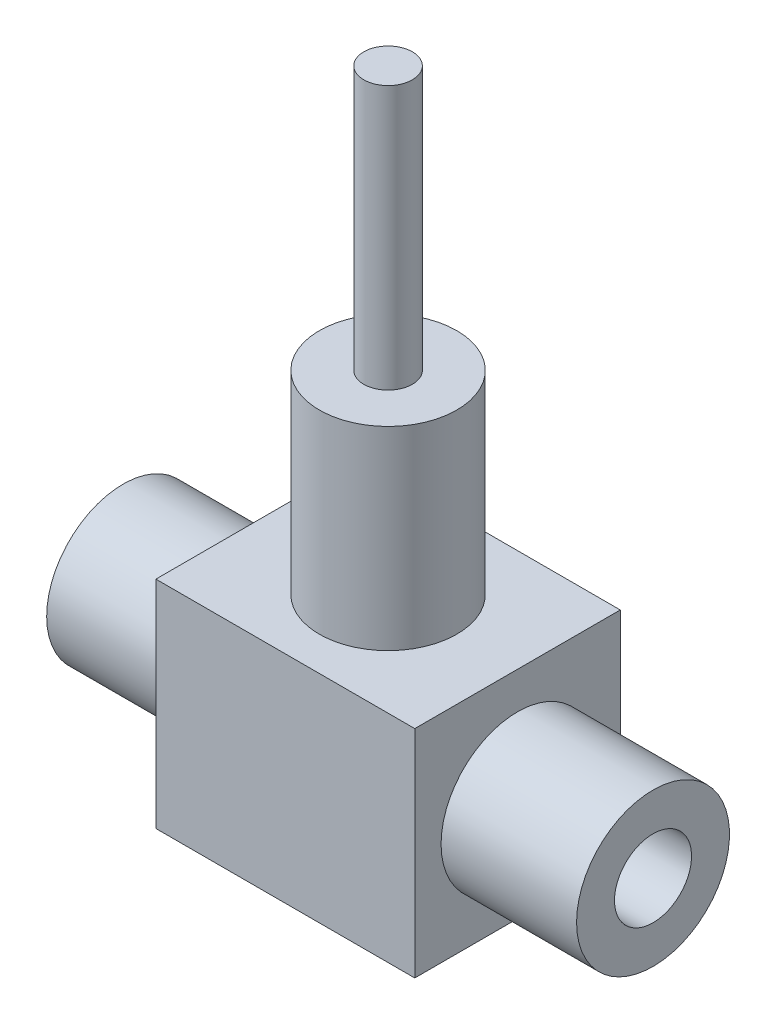
from build123d import *

# Parameters (mm, degrees)
BODY_SKETCH_W       = 32
BODY_SKETCH_H       = 26.7
BODY_DEPTH          = 12.7
NUT_X_SKETCH_W      = 16.75
NUT_X_SKETCH_H      = 9.45
NUT_X_SKETCH_2_W    = 16.75
NUT_X_SKETCH_2_H    = 9.45
SOCKET_X_SKETCH_W   = 17.8
SOCKET_X_SKETCH_H   = 4.7625
SOCKET_X_SKETCH_2_W = 17.8
SOCKET_X_SKETCH_2_H = 4.7625


with BuildPart() as part:
    # Body Sketch → Body (new, symmetric)
    with BuildSketch(Plane.XY):
        with Locations((0, 0.65)):
            Rectangle(BODY_SKETCH_W, BODY_SKETCH_H)
    extrude(amount=BODY_DEPTH, both=True)

    # Nut _X Sketch → Nut _X (revolve)
    with BuildSketch(Plane.XY):
        with Locations((24.375, 4.725)):
            Rectangle(NUT_X_SKETCH_W, NUT_X_SKETCH_H)
    revolve(axis=Axis((-1000, 0, 0), (1, 0, 0)))

    # Nut -X Sketch 2 → Nut -X 2 (revolve)
    with BuildSketch(Plane.XY):
        with Locations((-24.375, 4.725)):
            Rectangle(NUT_X_SKETCH_2_W, NUT_X_SKETCH_2_H)
    revolve(axis=Axis((-1000, 0, 0), (1, 0, 0)))

    # Socket _X Sketch → Socket _X (revolve, cut)
    with BuildSketch(Plane.XY):
        with Locations((24.85, 2.38125)):
            Rectangle(SOCKET_X_SKETCH_W, SOCKET_X_SKETCH_H)
    revolve(axis=Axis((-1000, 0, 0), (1, 0, 0)), mode=Mode.SUBTRACT)

    # Socket -X Sketch 2 → Socket -X 2 (revolve, cut)
    with BuildSketch(Plane.XY):
        with Locations((-24.85, 2.38125)):
            Rectangle(SOCKET_X_SKETCH_2_W, SOCKET_X_SKETCH_2_H)
    revolve(axis=Axis((-1000, 0, 0), (1, 0, 0)), mode=Mode.SUBTRACT)

    # Stem Sketch → Stem (revolve)
    with BuildSketch(Plane.XY):
        Polygon((0, 14), (8.5, 14), (8.5, 38), (3, 38), (3, 70.6), (0, 70.6), align=None)
    revolve(axis=Axis((0, -500, 0), (0, 1, 0)))


solid = part.part
